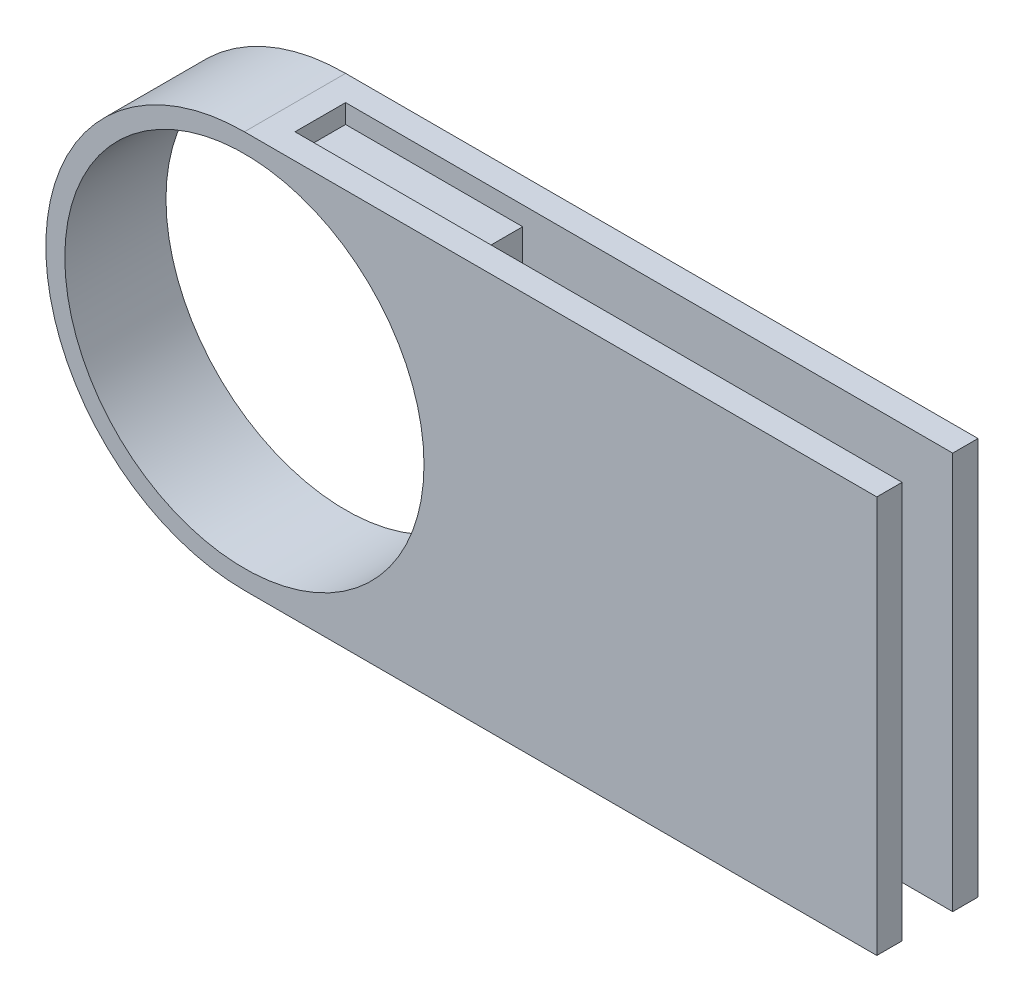
from build123d import *

# Parameters (mm, degrees)
SKETCH1_R                = 19.939
CIRCLE_EXTRUDE_DEPTH     = 7.62
SKETCH3_W                = 7.62
SKETCH3_H                = 39.878
RECTANGLE_EXTRUDE_DEPTH  = 63.5
SKETCH2_R                = 18.034
CRICLE_CUT_DEPTH         = 67.991627245
EXTENSION_START          = 2.54
EXTENSION_DEPTH          = 2.54
SKETCH15_R               = 18.034
CIRCLE_CUT_2_DEPTH       = 67.991627245
SKETCH16_W               = 5.08
SKETCH16_H               = 39.878
MIDDLE_CUT_DEPTH         = 49.167836997
SKETCH18_W               = 5.08
SKETCH18_H               = 1.905
CUT_EXTRUDE5_DEPTH       = 17.78
SKETCH19_R               = 1.905
FOR_SPRING_EXTRUDE_DEPTH = 2.54


with BuildPart() as part:
    # Sketch1 → circle extrude (new body)
    with BuildSketch(Plane.XY):
        with Locations(Location((0, 0, 0), (0, 0, 180))):
            Circle(SKETCH1_R)
    extrude(amount=CIRCLE_EXTRUDE_DEPTH)

    # Sketch3 → rectangle extrude (add)
    with BuildSketch(Plane(origin=(0, 0, 0), x_dir=(0, 0, -1), z_dir=(1, 0, 0))):
        with Locations((-3.81, 0)):
            Rectangle(SKETCH3_W, SKETCH3_H)
    extrude(amount=RECTANGLE_EXTRUDE_DEPTH)

    # Sketch2 → cricle cut (cut, through all)
    with BuildSketch(Plane.XY.offset(7.62)):
        Circle(SKETCH2_R)
    extrude(amount=-CRICLE_CUT_DEPTH, mode=Mode.SUBTRACT)

    # Sketch10 → extension (add)
    with BuildSketch(Plane(origin=(0, 0, 0), x_dir=(-1, 0, 0), z_dir=(0, 0, -1)).offset(EXTENSION_START)):
        with BuildLine():
            Line((0, 19.939), (-63.5, 19.939))
            Line((-63.5, 19.939), (-63.5, -19.939))
            Line((-63.5, -19.939), (0, -19.939))
            ThreePointArc((0, -19.939), (19.939, 0), (0, 19.939))
        make_face()
    extrude(amount=-EXTENSION_DEPTH)

    # Sketch15 → circle cut 2 (cut, through all)
    with BuildSketch(Plane.XY):
        Circle(SKETCH15_R)
    extrude(amount=-CIRCLE_CUT_2_DEPTH, mode=Mode.SUBTRACT)

    # Sketch16 → middle cut (cut, through all)
    with BuildSketch(Plane(origin=(20.32, 0, 0), x_dir=(0, 0, -1), z_dir=(1, 0, 0))):
        with Locations((-2.54, 0)):
            Rectangle(SKETCH16_W, SKETCH16_H)
    extrude(amount=MIDDLE_CUT_DEPTH, mode=Mode.SUBTRACT)

    # Sketch18 → Cut-Extrude5 (cut)
    with BuildSketch(Plane(origin=(20.32, 0, 0), x_dir=(0, 0, -1), z_dir=(1, 0, 0))):
        with Locations((-2.54, 18.9865)):
            Rectangle(SKETCH18_W, SKETCH18_H)
    extrude(amount=-CUT_EXTRUDE5_DEPTH, mode=Mode.SUBTRACT)

    # Sketch19 → for spring extrude (add)
    with BuildSketch(Plane(origin=(20.32, 0, 0), x_dir=(0, 0, -1), z_dir=(1, 0, 0))):
        with Locations((-2.54, 0)):
            Circle(SKETCH19_R)
    extrude(amount=FOR_SPRING_EXTRUDE_DEPTH)


solid = part.part
